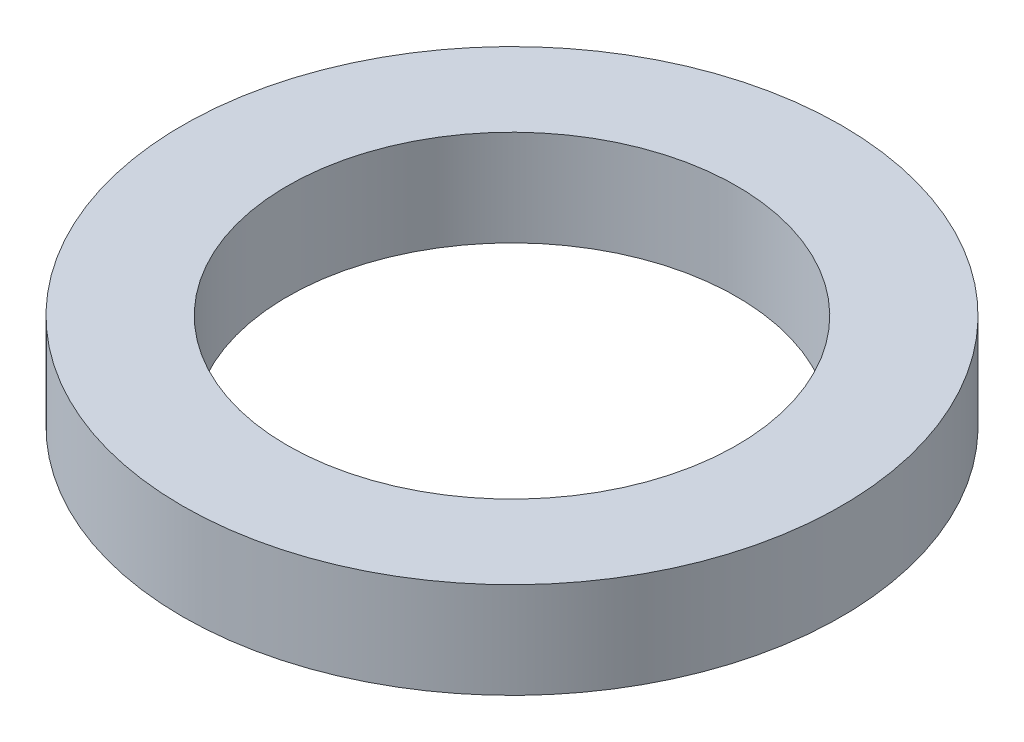
from build123d import *

# Parameters (mm, degrees)
SKETCH1_R           = 55
SKETCH1_R_2         = 37.5
BOSS_EXTRUDE1_DEPTH = 16


with BuildPart() as part:
    # Sketch1 → Boss-Extrude1 (new body)
    with BuildSketch(Plane(origin=(0, 0, 0), x_dir=(1, 0, 0), z_dir=(0, 1, 0))):
        with Locations(Location((0, 0, 0), (0, 0, 270))):
            Circle(SKETCH1_R)
        with Locations(Location((0, 0, 0), (0, 0, 270))):
            Circle(SKETCH1_R_2, mode=Mode.SUBTRACT)
    extrude(amount=BOSS_EXTRUDE1_DEPTH)


solid = part.part
